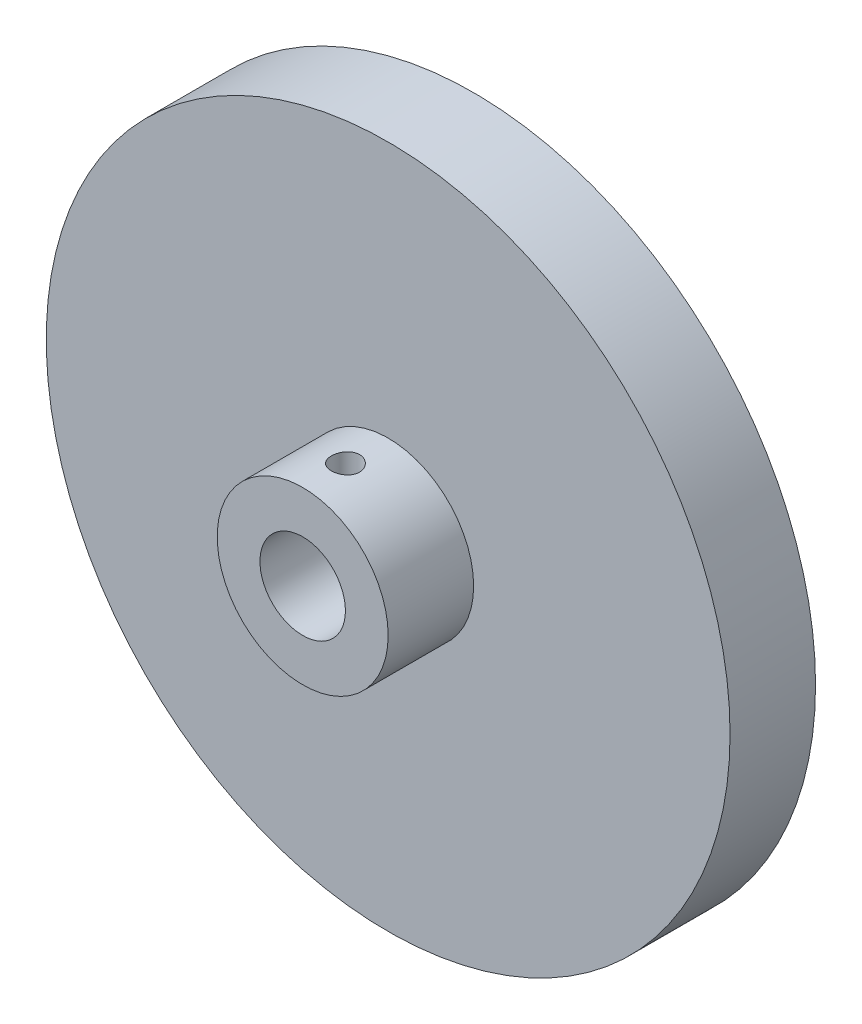
from build123d import *

# Parameters (mm, degrees)
SKETCH1_R           = 40
BOSS_EXTRUDE1_DEPTH = 10
SKETCH2_R           = 10
BOSS_EXTRUDE2_DEPTH = 10
SKETCH3_R           = 5
CUT_EXTRUDE1_DEPTH  = 20
SKETCH4_R           = 1.65
CUT_EXTRUDE2_DEPTH  = 10


with BuildPart() as part:
    # Sketch1 → Boss-Extrude1 (new body)
    with BuildSketch(Plane.XY):
        Circle(SKETCH1_R)
    extrude(amount=BOSS_EXTRUDE1_DEPTH)

    # Sketch2 → Boss-Extrude2 (add)
    with BuildSketch(Plane.XY.offset(10)):
        Circle(SKETCH2_R)
    extrude(amount=BOSS_EXTRUDE2_DEPTH)

    # Sketch3 → Cut-Extrude1 (cut)
    with BuildSketch(Plane.XY):
        Circle(SKETCH3_R)
    extrude(amount=CUT_EXTRUDE1_DEPTH, mode=Mode.SUBTRACT)

    # Sketch4 → Cut-Extrude2 (cut)
    with BuildSketch(Plane(origin=(0, 0, 0), x_dir=(1, 0, 0), z_dir=(0, 1, 0))):
        with Locations((0, -15)):
            Circle(SKETCH4_R)
    extrude(amount=CUT_EXTRUDE2_DEPTH, mode=Mode.SUBTRACT)


solid = part.part
